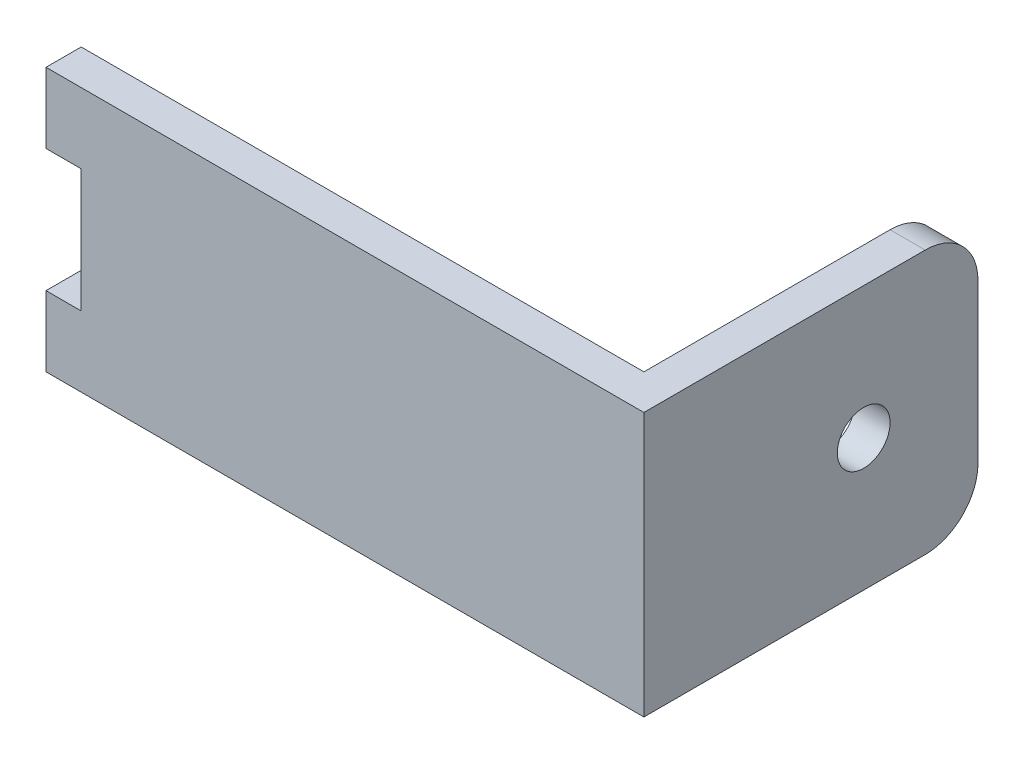
from build123d import *

# Parameters (mm, degrees)
SKETCH1_W           = 30
SKETCH1_H           = 15
BOSS_EXTRUDE1_DEPTH = 2
SKETCH2_W           = 19
SKETCH2_H           = 15
BOSS_EXTRUDE2_DEPTH = 2
SKETCH3_R           = 1.5
CUT_EXTRUDE1_DEPTH  = 2
FILLET1_R           = 3
SKETCH4_W           = 2
SKETCH4_H           = 4
BOSS_EXTRUDE3_DEPTH = 2


with BuildPart() as part:
    # Sketch1 → Boss-Extrude1 (new body)
    with BuildSketch(Plane.XY):
        with Locations((15, 7.5)):
            Rectangle(SKETCH1_W, SKETCH1_H)
    extrude(amount=BOSS_EXTRUDE1_DEPTH)

    # Sketch2 → Boss-Extrude2 (add)
    with BuildSketch(Plane(origin=(30, 0, 0), x_dir=(0, 0, -1), z_dir=(1, 0, 0))):
        with Locations((7.5, 7.5)):
            Rectangle(SKETCH2_W, SKETCH2_H)
    extrude(amount=BOSS_EXTRUDE2_DEPTH)

    # Sketch3 → Cut-Extrude1 (cut)
    with BuildSketch(Plane(origin=(32, 0, 0), x_dir=(0, 0, -1), z_dir=(1, 0, 0))):
        with Locations((10.5, 7.5)):
            Circle(SKETCH3_R)
    extrude(amount=-CUT_EXTRUDE1_DEPTH, mode=Mode.SUBTRACT)

    # Fillet1
    fillet1_edges = [part.edges().sort_by_distance(p)[0] for p in [
        (31, 0, -17),
        (31, 15, -17),
    ]]
    fillet(fillet1_edges, radius=FILLET1_R)

    # Sketch4 → Boss-Extrude3 (add)
    with BuildSketch(Plane.ZY):
        with Locations((1, 13)):
            Rectangle(SKETCH4_W, SKETCH4_H)
        with Locations((1, 2)):
            Rectangle(SKETCH4_W, SKETCH4_H)
    extrude(amount=BOSS_EXTRUDE3_DEPTH)


solid = part.part
